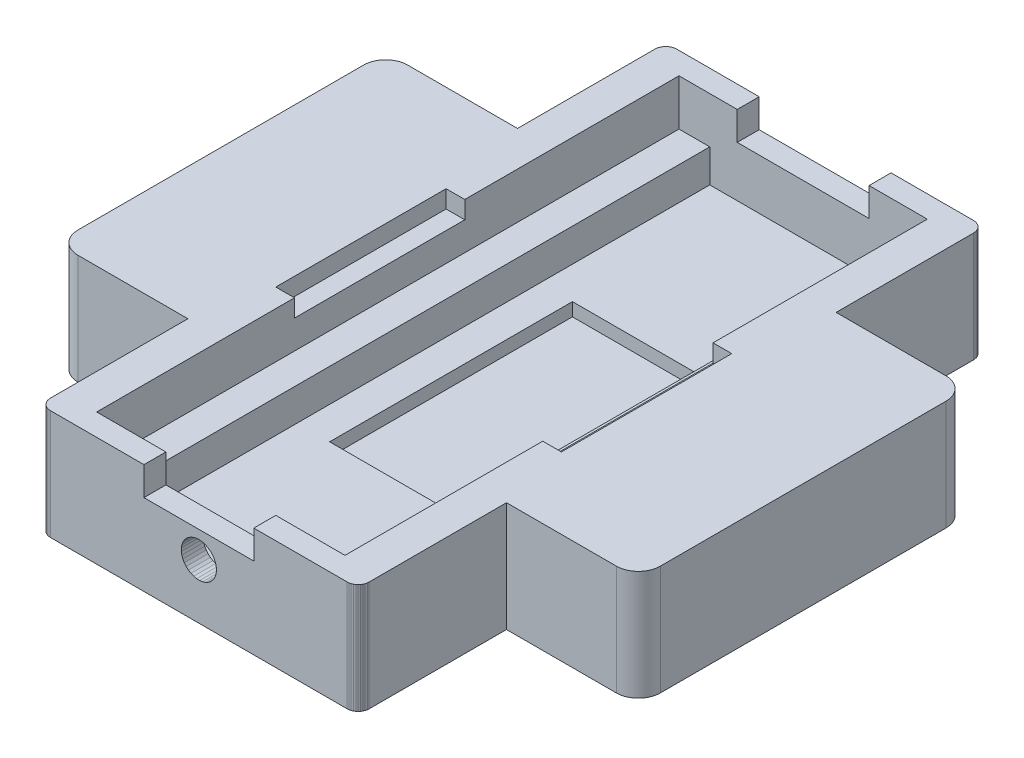
from build123d import *

# Parameters (mm, degrees)
BOSS_EXTRUDE1_DEPTH = 9.999999776
SKETCH2_W           = 17.000000924
SKETCH2_H           = 52.999999374
CUT_EXTRUDE1_DEPTH  = 7.199999876
CUT_EXTRUDE2_REACH  = 66.216
SKETCH4_W           = 2.799998969
SKETCH4_H           = 52.999999374
CUT_EXTRUDE3_REACH  = 66.216
SKETCH6_W           = 2.7999999
SKETCH6_H           = 52.999999374
CUT_EXTRUDE4_REACH  = 66.73
SKETCH7_W           = 10.000000707
SKETCH7_H           = 2.599999774
CUT_EXTRUDE5_REACH  = 66.73
SKETCH8_W           = 12.000000104
SKETCH8_H           = 2.599999774
CUT_EXTRUDE6_DEPTH  = 63.976185295
SKETCH10_W          = 1.699999906
SKETCH10_H          = 15.499999747
CUT_EXTRUDE7_DEPTH  = 1.600000076
SKETCH11_W          = 1.700000837
SKETCH11_H          = 15.499999747
CUT_EXTRUDE8_DEPTH  = 1.600000076
SKETCH12_W          = 11.099998839
SKETCH12_H          = 22.099997848
CUT_EXTRUDE9_DEPTH  = 1.199999941
SKETCH13_W          = 30
SKETCH13_H          = 9.999999776
BOSS_EXTRUDE2_DEPTH = 12
SKETCH14_W          = 30
SKETCH14_H          = 9.999999776
BOSS_EXTRUDE3_DEPTH = 12
FILLET1_R           = 2


with BuildPart() as part:
    # Sketch1 → Boss-Extrude1 (new body)
    with BuildSketch(Plane.XZ):
        Polygon((0.84356498, 0.012312084), (0.999999233, 0), (28.000000864, 0), (28.156435117, 0.012312084), (28.30901742, 0.048942864), (28.453988954, 0.108992681), (28.587784618, 0.190982595), (28.707107529, 0.292893499), (28.80901657, 0.412214547), (28.891006485, 0.546010211), (28.951056302, 0.690983608), (28.987688944, 0.843565969), (28.999999166, 1.000000164), (28.999999166, 56.000001729), (28.987688944, 56.156434119), (28.951056302, 56.309018284), (28.891006485, 56.453991681), (28.80901657, 56.587785482), (28.707107529, 56.707106531), (28.587784618, 56.809015572), (28.453988954, 56.891005486), (28.30901742, 56.951057166), (28.156435117, 56.987687945), (28.000000864, 57.00000003), (0.999999233, 57.00000003), (0.84356498, 56.987687945), (0.690982677, 56.951057166), (0.54600928, 56.891005486), (0.412214547, 56.809015572), (0.292892568, 56.707106531), (0.190982595, 56.587785482), (0.108992681, 56.453991681), (0.048942864, 56.309018284), (0.012311153, 56.156434119), (0, 56.000001729), (0, 1.000000164), (0.012311153, 0.843565969), (0.048942864, 0.690983608), (0.108992681, 0.546010211), (0.190982595, 0.412214547), (0.292892568, 0.292893499), (0.412214547, 0.190982595), (0.54600928, 0.108992681), (0.690982677, 0.048942864), align=None)
    extrude(amount=-BOSS_EXTRUDE1_DEPTH)

    # Sketch2 → Cut-Extrude1 (cut)
    with BuildSketch(Plane(origin=(0, 9.999999776, 0), x_dir=(-1, 0, 0), z_dir=(0, 1, 0))):
        with Locations((-14.499999583, 28.500000015)):
            Rectangle(SKETCH2_W, SKETCH2_H)
    extrude(amount=-CUT_EXTRUDE1_DEPTH, mode=Mode.SUBTRACT)

    # Sketch4 → Cut-Extrude2 (cut, up to next)
    with BuildSketch(Plane.XZ.offset(-5.799999926), mode=Mode.PRIVATE) as cut_extrude2_sk1:
        with Locations((24.39999953, 28.500000015)):
            Rectangle(SKETCH4_W, SKETCH4_H)
    cut_extrude2_tool1 = extrude(cut_extrude2_sk1.sketch, amount=-CUT_EXTRUDE2_REACH, mode=Mode.PRIVATE) & part.part
    add(cut_extrude2_tool1.solids().sort_by_distance((24.4, 5.8, 28.5))[0], mode=Mode.SUBTRACT)

    # Sketch6 → Cut-Extrude3 (cut, up to next)
    with BuildSketch(Plane.XZ.offset(-5.799999926), mode=Mode.PRIVATE) as cut_extrude3_sk1:
        with Locations((4.599999171, 28.500000015)):
            Rectangle(SKETCH6_W, SKETCH6_H)
    cut_extrude3_tool1 = extrude(cut_extrude3_sk1.sketch, amount=-CUT_EXTRUDE3_REACH, mode=Mode.PRIVATE) & part.part
    add(cut_extrude3_tool1.solids().sort_by_distance((4.599999, 5.8, 28.5))[0], mode=Mode.SUBTRACT)

    # Sketch7 → Cut-Extrude4 (cut, up to next)
    with BuildSketch(Plane.XY.offset(57.00000003), mode=Mode.PRIVATE) as cut_extrude4_sk1:
        with Locations((14.500000049, 8.699999889)):
            Rectangle(SKETCH7_W, SKETCH7_H)
    cut_extrude4_tool1 = extrude(cut_extrude4_sk1.sketch, amount=-CUT_EXTRUDE4_REACH, mode=Mode.PRIVATE) & part.part
    add(cut_extrude4_tool1.solids().sort_by_distance((14.5, 8.7, 57))[0], mode=Mode.SUBTRACT)

    # Sketch8 → Cut-Extrude5 (cut, up to next)
    with BuildSketch(Plane(origin=(0, 0, 0), x_dir=(-1, 0, 0), z_dir=(0, 0, -1)), mode=Mode.PRIVATE) as cut_extrude5_sk1:
        with Locations((-14.500000514, 8.699999889)):
            Rectangle(SKETCH8_W, SKETCH8_H)
    cut_extrude5_tool1 = extrude(cut_extrude5_sk1.sketch, amount=-CUT_EXTRUDE5_REACH, mode=Mode.PRIVATE) & part.part
    add(cut_extrude5_tool1.solids().sort_by_distance((14.500001, 8.7, 0))[0], mode=Mode.SUBTRACT)

    # Sketch9 → Cut-Extrude6 (cut, through all)
    with BuildSketch(Plane(origin=(0, 0, 54.999999702), x_dir=(-1, 0, 0), z_dir=(0, 0, -1))):
        Polygon((-16.008604318, 4.466976505), (-15.896821395, 4.219688009), (-15.74485749, 3.994848114), (-15.557079576, 3.798924387), (-15.338891186, 3.637553426), (-15.096570365, 3.515377408), (-14.837087132, 3.435911611), (-14.567905106, 3.401441732), (-14.296771027, 3.412959399), (-14.03148286, 3.470133292), (-13.779673725, 3.571318695), (-13.548586518, 3.713604528), (-13.344869949, 3.892897861), (-13.174383901, 4.104040563), (-13.042034581, 4.34095785), (-12.951626442, 4.596835002), (-12.905763462, 4.86431038), (-12.905763462, 5.135689396), (-12.951626442, 5.403164774), (-13.042034581, 5.659041926), (-13.174383901, 5.895959679), (-13.344869949, 6.107102148), (-13.548586518, 6.286395248), (-13.779673725, 6.428681314), (-14.03148286, 6.529866718), (-14.296771027, 6.587040611), (-14.567905106, 6.598558277), (-14.837087132, 6.564088166), (-15.096570365, 6.484622601), (-15.338891186, 6.362446584), (-15.557079576, 6.201075856), (-15.74485749, 6.005152129), (-15.896821395, 5.780311767), (-16.008604318, 5.533023737), (-16.076983884, 5.270401482), (-16.10000059, 4.999999888), (-16.076983884, 4.729599226), align=None)
    extrude(amount=-CUT_EXTRUDE6_DEPTH, mode=Mode.SUBTRACT)

    # Sketch10 → Cut-Extrude7 (cut)
    with BuildSketch(Plane(origin=(0, 9.999999776, 0), x_dir=(-1, 0, 0), z_dir=(0, 1, 0))):
        with Locations((-2.349999268, 29.250000603)):
            Rectangle(SKETCH10_W, SKETCH10_H)
    extrude(amount=-CUT_EXTRUDE7_DEPTH, mode=Mode.SUBTRACT)

    # Sketch11 → Cut-Extrude8 (cut)
    with BuildSketch(Plane(origin=(0, 9.999999776, 0), x_dir=(-1, 0, 0), z_dir=(0, 1, 0))):
        with Locations((-26.649999433, 29.250000603)):
            Rectangle(SKETCH11_W, SKETCH11_H)
    extrude(amount=-CUT_EXTRUDE8_DEPTH, mode=Mode.SUBTRACT)

    # Sketch12 → Cut-Extrude9 (cut)
    with BuildSketch(Plane(origin=(0, 2.7999999, 0), x_dir=(-1, 0, 0), z_dir=(0, 1, 0))):
        with Locations((-14.499999117, 28.500000015)):
            Rectangle(SKETCH12_W, SKETCH12_H)
    extrude(amount=-CUT_EXTRUDE9_DEPTH, mode=Mode.SUBTRACT)

    # Sketch13 → Boss-Extrude2 (add)
    with BuildSketch(Plane.ZY):
        with Locations((28.500000946, 4.999999888)):
            Rectangle(SKETCH13_W, SKETCH13_H)
    extrude(amount=BOSS_EXTRUDE2_DEPTH)

    # Sketch14 → Boss-Extrude3 (add)
    with BuildSketch(Plane(origin=(28.999999166, 0, 0), x_dir=(0, 0, -1), z_dir=(1, 0, 0))):
        with Locations((-28.500000946, 4.999999888)):
            Rectangle(SKETCH14_W, SKETCH14_H)
    extrude(amount=BOSS_EXTRUDE3_DEPTH)

    # Fillet1
    fillet1_edges = [part.edges().sort_by_distance(p)[0] for p in [
        (-12, 4.999999888, 13.500000946),
        (-12, 4.999999888, 43.500000946),
        (40.999999166, 4.999999888, 43.500000946),
        (40.999999166, 4.999999888, 13.500000946),
    ]]
    fillet(fillet1_edges, radius=FILLET1_R)


solid = part.part
